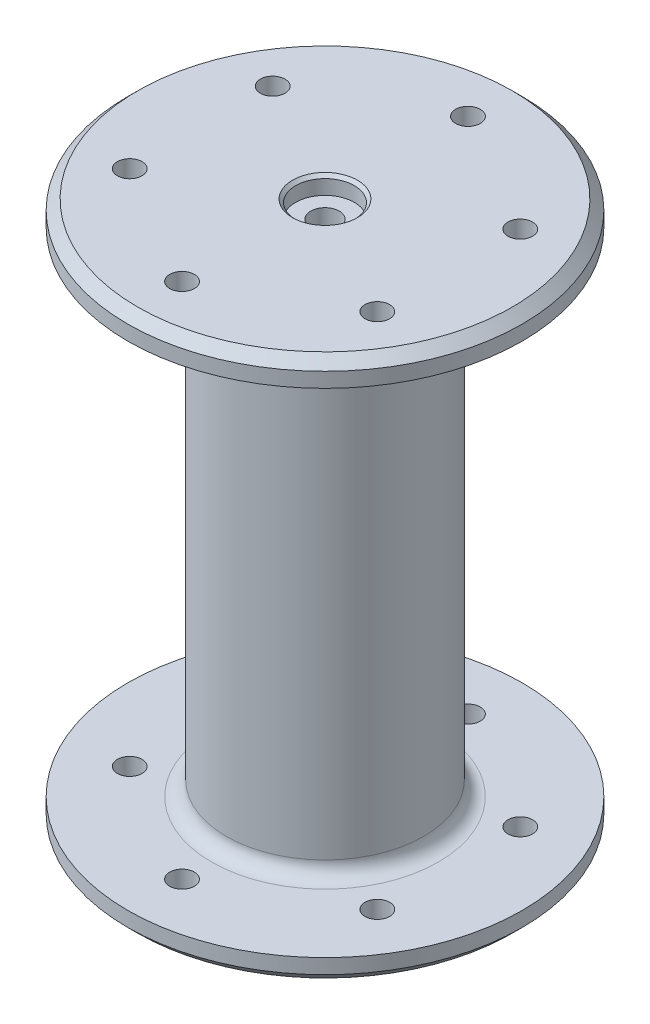
from build123d import *

# Parameters (mm, degrees)
SKETCH1_R                = 20
BOSS_EXTRUDE1_DEPTH      = 50
SKETCH2_R                = 40
BOSS_EXTRUDE2_DEPTH      = 5
CHAMFER1_SIZE            = 2
SKETCH3_R                = 2.5
CUT_EXTRUDE1_DEPTH       = 120.268604419
CIRPATTERN1_COUNT        = 6
FILLET4_R                = 3
MIRROR1_COPY_1_SKETCH_R  = 2.5
MIRROR1_COPY_1_DEPTH     = 120.268604419
MIRROR1_COPY_2_SKETCH_R  = 2.5
MIRROR1_COPY_2_DEPTH     = 120.268604419
MIRROR1_COPY_3_SKETCH_R  = 2.5
MIRROR1_COPY_3_DEPTH     = 120.268604419
MIRROR1_COPY_4_SKETCH_R  = 2.5
MIRROR1_COPY_4_DEPTH     = 120.268604419
MIRROR1_COPY_5_SKETCH_R  = 2.5
MIRROR1_COPY_5_DEPTH     = 120.268604419
CHAMFER1_OF_MIRROR1_SIZE = 2
FILLET4_OF_MIRROR1_R     = 3


with BuildPart() as part:
    # Sketch1 → Boss-Extrude1 (new, symmetric)
    with BuildSketch(Plane(origin=(0, 0, 0), x_dir=(1, 0, 0), z_dir=(0, 1, 0))):
        with Locations(Location((0, 0, 0), (0, 0, 270))):
            Circle(SKETCH1_R)
    extrude(amount=BOSS_EXTRUDE1_DEPTH, both=True)

    # Sketch2 → Boss-Extrude2 (add)
    with BuildSketch(Plane(origin=(0, 50, 0), x_dir=(1, 0, 0), z_dir=(0, 1, 0))):
        with Locations(Location((0, 0, 0), (0, 0, 270))):
            Circle(SKETCH2_R)
    boss_extrude2 = extrude(amount=BOSS_EXTRUDE2_DEPTH)

    # Chamfer1
    chamfer1_edges = [part.edges().sort_by_distance(p)[0] for p in [
        (0, 55, -40),
    ]]
    chamfer(chamfer1_edges, length=CHAMFER1_SIZE)

    # Sketch3 → Cut-Extrude1 (cut, through all)
    with BuildSketch(Plane(origin=(0, 55, 0), x_dir=(1, 0, 0), z_dir=(0, 1, 0))):
        with Locations(Location((0, 29, 0), (0, 0, 270))):
            Circle(SKETCH3_R)
    cut_extrude1 = extrude(amount=-CUT_EXTRUDE1_DEPTH, mode=Mode.SUBTRACT)

    # CirPattern1: Cut-Extrude1 ×6 about axis
    cirpattern1_axis = Axis((0, 0, 0), (0, 1, 0))
    for i in range(1, CIRPATTERN1_COUNT):
        add(cut_extrude1.rotate(cirpattern1_axis, i * 360 / CIRPATTERN1_COUNT), mode=Mode.SUBTRACT)

    # Fillet4
    fillet4_edges = [part.edges().sort_by_distance(p)[0] for p in [
        (0, 50, -20),
    ]]
    fillet(fillet4_edges, radius=FILLET4_R)

    # Sketch5 → CBORE for #12 Binding Head Machine Screw1 (revolve, cut)
    with BuildSketch(Plane(origin=(0, 55, 0), x_dir=(0, 0, 1), z_dir=(1, 0, 0))):
        Polygon((0, 0), (0, 110), (2.8956, 110), (2.8956, 3.5814), (5.95376, 3.5814), (5.95376, 0.635), (6.58876, 0), align=None)
    cbore_for_12_binding_head_machine_screw = revolve(axis=Axis((0, 61.35, 0), (0, -1, 0)), mode=Mode.SUBTRACT)

    # Mirror1: Boss-Extrude2, Cut-Extrude1, CBORE for #12 Binding Head Machine Screw1 across plane
    add(boss_extrude2.mirror(Plane.ZX))
    add(cut_extrude1.mirror(Plane.ZX), mode=Mode.SUBTRACT)
    add(cbore_for_12_binding_head_machine_screw.mirror(Plane.ZX), mode=Mode.SUBTRACT)

    # Mirror1 copy 1 sketch → Mirror1 copy 1 (cut, through all)
    with BuildSketch(Plane(origin=(0, -55, 0), x_dir=(0.5000000000000001, 0, -0.8660254037844386), z_dir=(0, -1, 0))):
        with Locations((0, -29)):
            Circle(MIRROR1_COPY_1_SKETCH_R)
    extrude(amount=-MIRROR1_COPY_1_DEPTH, mode=Mode.SUBTRACT)

    # Mirror1 copy 2 sketch → Mirror1 copy 2 (cut, through all)
    with BuildSketch(Plane(origin=(0, -55, 0), x_dir=(-0.4999999999999998, 0, -0.8660254037844387), z_dir=(0, -1, 0))):
        with Locations((0, -29)):
            Circle(MIRROR1_COPY_2_SKETCH_R)
    extrude(amount=-MIRROR1_COPY_2_DEPTH, mode=Mode.SUBTRACT)

    # Mirror1 copy 3 sketch → Mirror1 copy 3 (cut, through all)
    with BuildSketch(Plane(origin=(0, -55, 0), x_dir=(-1, 0, 0), z_dir=(0, -1, 0))):
        with Locations((0, -29)):
            Circle(MIRROR1_COPY_3_SKETCH_R)
    extrude(amount=-MIRROR1_COPY_3_DEPTH, mode=Mode.SUBTRACT)

    # Mirror1 copy 4 sketch → Mirror1 copy 4 (cut, through all)
    with BuildSketch(Plane(origin=(0, -55, 0), x_dir=(-0.5000000000000004, 0, 0.8660254037844384), z_dir=(0, -1, 0))):
        with Locations((0, -29)):
            Circle(MIRROR1_COPY_4_SKETCH_R)
    extrude(amount=-MIRROR1_COPY_4_DEPTH, mode=Mode.SUBTRACT)

    # Mirror1 copy 5 sketch → Mirror1 copy 5 (cut, through all)
    with BuildSketch(Plane(origin=(0, -55, 0), x_dir=(0.5000000000000001, 0, 0.8660254037844386), z_dir=(0, -1, 0))):
        with Locations((0, -29)):
            Circle(MIRROR1_COPY_5_SKETCH_R)
    extrude(amount=-MIRROR1_COPY_5_DEPTH, mode=Mode.SUBTRACT)

    # Chamfer1 of Mirror1
    chamfer1_of_mirror1_edges = [part.edges().sort_by_distance(p)[0] for p in [
        (0, -55, -40),
    ]]
    chamfer(chamfer1_of_mirror1_edges, length=CHAMFER1_OF_MIRROR1_SIZE)

    # Fillet4 of Mirror1
    fillet4_of_mirror1_edges = [part.edges().sort_by_distance(p)[0] for p in [
        (0, -50, -20),
    ]]
    fillet(fillet4_of_mirror1_edges, radius=FILLET4_OF_MIRROR1_R)


solid = part.part
